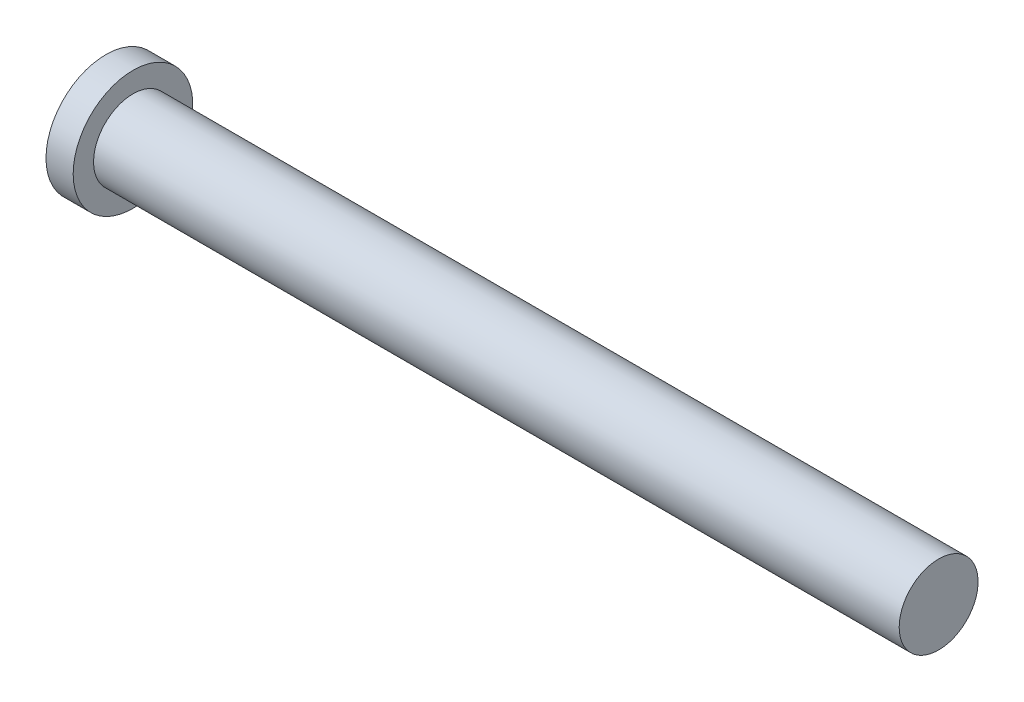
from build123d import *


with BuildPart() as part:
    # Skizze1 → Rotation1 (revolve)
    with BuildSketch(Plane.XY, mode=Mode.PRIVATE) as rotation1_sk:
        Polygon((0, 2.25), (0, 6.825), (3.1, 6.825), (3.1, 4.5), (95, 4.5), (95, 0), (83.5, 0), (83.5, 2.25), align=None)
    revolve(rotation1_sk.sketch.rotate(Axis((0, 0, 0), (1, 0, 0)), 90), axis=Axis((0, 0, 0), (1, 0, 0)))


solid = part.part
